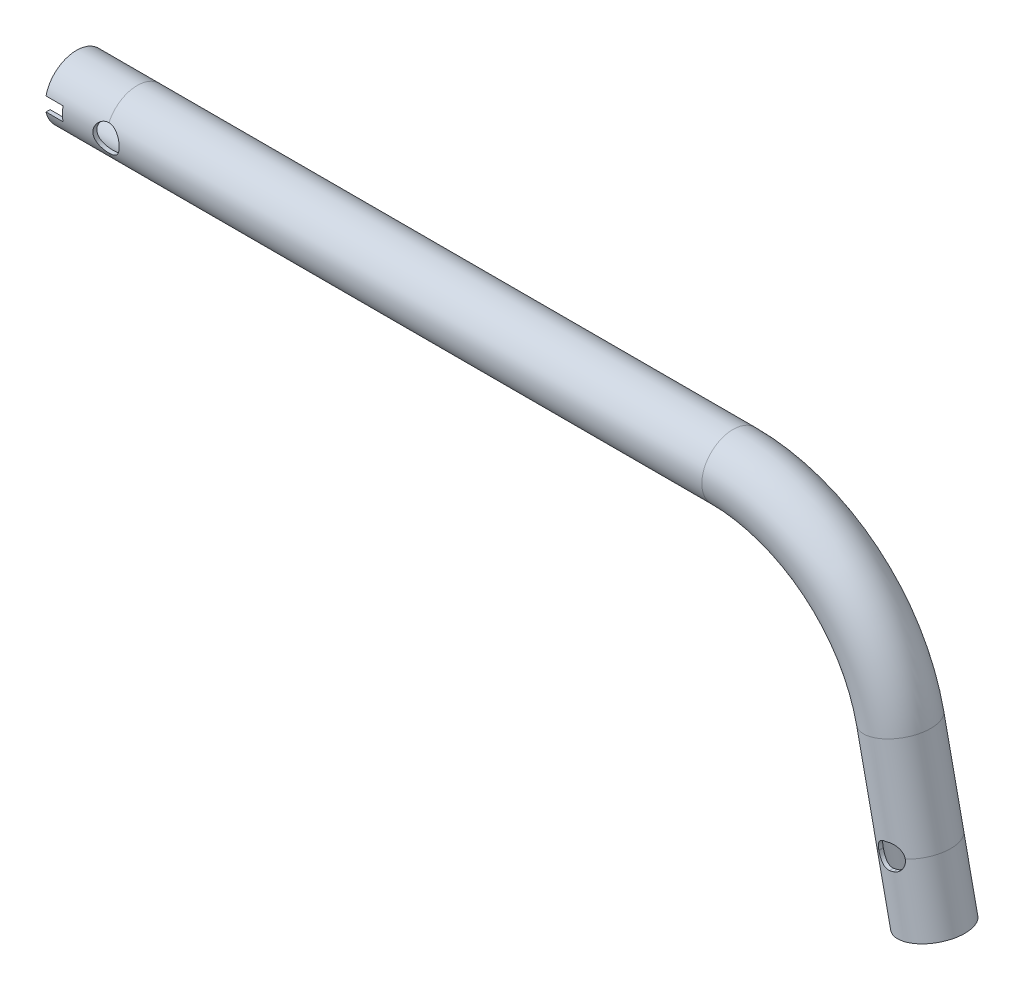
from build123d import *

# Parameters (mm, degrees)
SKETCH2_R                      = 9.5
SKETCH2_R_2                    = 8.3
CUT_EXTRUDE1_REACH             = 270.227
CUT_EXTRUDE1_DIRECTION_2_REACH = 270.227
CUT_EXTRUDE2_REACH             = 270.227
CUT_EXTRUDE2_END_RADIUS        = 9.5
SKETCH4_R                      = 4
CUT_EXTRUDE3_DEPTH             = 269.227315267
CUT_EXTRUDE3_DEPTH_BACK        = 269.227315267


with BuildPart() as part:
    # Sweep1: sweep along a path in Sketch1
    with BuildLine(Plane.XY) as sweep1_path:
        Line((-18.506357454, 0), (0, 0))
        Line((0, 0), (181.254782269, 0))
        ThreePointArc((181.254782269, 0), (213.979442604, -11.588410004), (232.118457507, -41.188592077))
        Line((232.118457507, -41.188592077), (238.2, -69.8))
        Line((238.2, -69.8), (242.493642546, -90))
    # Sketch2 → Sweep1 (sweep)
    with BuildSketch(Plane.ZY.offset(18.506357454)):
        Circle(SKETCH2_R)
        Circle(SKETCH2_R_2, mode=Mode.SUBTRACT)
    sweep(path=sweep1_path.line)

    # Sketch3 → Cut-Extrude1 (cut, up to next)
    with BuildSketch(Plane.XY, mode=Mode.PRIVATE) as cut_extrude1_sk1:
        with BuildLine():
            Line((242.227778512, -69.029297246), (242.193031815, -68.865826889))
            ThreePointArc((242.193031815, -68.865826889), (240.675751834, -66.658170819), (238.041824294, -66.170001204))
            Line((238.041824294, -66.170001204), (236.868047173, -66.419495233))
            ThreePointArc((236.868047173, -66.419495233), (234.660391103, -67.936775213), (234.172221488, -70.570702754))
            Line((234.172221488, -70.570702754), (234.206968185, -70.734173111))
            ThreePointArc((234.206968185, -70.734173111), (235.724248166, -72.941829181), (238.358175706, -73.429998796))
            Line((238.358175706, -73.429998796), (239.531952827, -73.180504767))
            ThreePointArc((239.531952827, -73.180504767), (241.739608897, -71.663224787), (242.227778512, -69.029297246))
        make_face()
    cut_extrude1_tool1 = extrude(cut_extrude1_sk1.sketch, amount=-CUT_EXTRUDE1_REACH, mode=Mode.PRIVATE) & part.part
    add(cut_extrude1_tool1.solids().sort_by_distance((238.2, -69.8, 0))[0], mode=Mode.SUBTRACT)

    # Sketch3 → Cut-Extrude1 direction 2 (cut, up to next)
    with BuildSketch(Plane.XY, mode=Mode.PRIVATE) as cut_extrude1_direction_2_sk1:
        with BuildLine():
            Line((242.227778512, -69.029297246), (242.193031815, -68.865826889))
            ThreePointArc((242.193031815, -68.865826889), (240.675751834, -66.658170819), (238.041824294, -66.170001204))
            Line((238.041824294, -66.170001204), (236.868047173, -66.419495233))
            ThreePointArc((236.868047173, -66.419495233), (234.660391103, -67.936775213), (234.172221488, -70.570702754))
            Line((234.172221488, -70.570702754), (234.206968185, -70.734173111))
            ThreePointArc((234.206968185, -70.734173111), (235.724248166, -72.941829181), (238.358175706, -73.429998796))
            Line((238.358175706, -73.429998796), (239.531952827, -73.180504767))
            ThreePointArc((239.531952827, -73.180504767), (241.739608897, -71.663224787), (242.227778512, -69.029297246))
        make_face()
    cut_extrude1_direction_2_tool1 = extrude(cut_extrude1_direction_2_sk1.sketch, amount=CUT_EXTRUDE1_DIRECTION_2_REACH, mode=Mode.PRIVATE) & part.part
    add(cut_extrude1_direction_2_tool1.solids().sort_by_distance((238.2, -69.8, 0))[0], mode=Mode.SUBTRACT)

    # Cut-Extrude2: up to this cylinder (the profile starts inside it)
    cut_extrude2_end = Plane(origin=(0, 0, 0), z_dir=(-1, 0, 0)) * Cylinder(CUT_EXTRUDE2_END_RADIUS, 560.454, mode=Mode.PRIVATE)
    # Sketch4 → Cut-Extrude2 (cut, up to the surface)
    with BuildSketch(Plane.XY, mode=Mode.PRIVATE) as cut_extrude2_sk1:
        with Locations(Location((0, 0, 0), (0, 0, 90))):
            Circle(SKETCH4_R)
    cut_extrude2_tool1 = extrude(cut_extrude2_sk1.sketch, amount=CUT_EXTRUDE2_REACH, mode=Mode.PRIVATE) & cut_extrude2_end
    add(cut_extrude2_tool1.solids().sort_by_distance((0, 0, 0))[0], mode=Mode.SUBTRACT)

    # Sketch5 → Cut-Extrude3 (cut, two sides: drawn at the far end of the back side and taken through both)
    with BuildSketch(Plane.XY.offset(-CUT_EXTRUDE3_DEPTH_BACK)):
        Polygon((-18.506357454, 0), (-18.506357454, 2.1), (-13.306357454, 2.1), (-13.306357454, -2.1), (-18.506357454, -2.1), align=None)
    extrude(amount=CUT_EXTRUDE3_DEPTH + CUT_EXTRUDE3_DEPTH_BACK, mode=Mode.SUBTRACT)


solid = part.part
